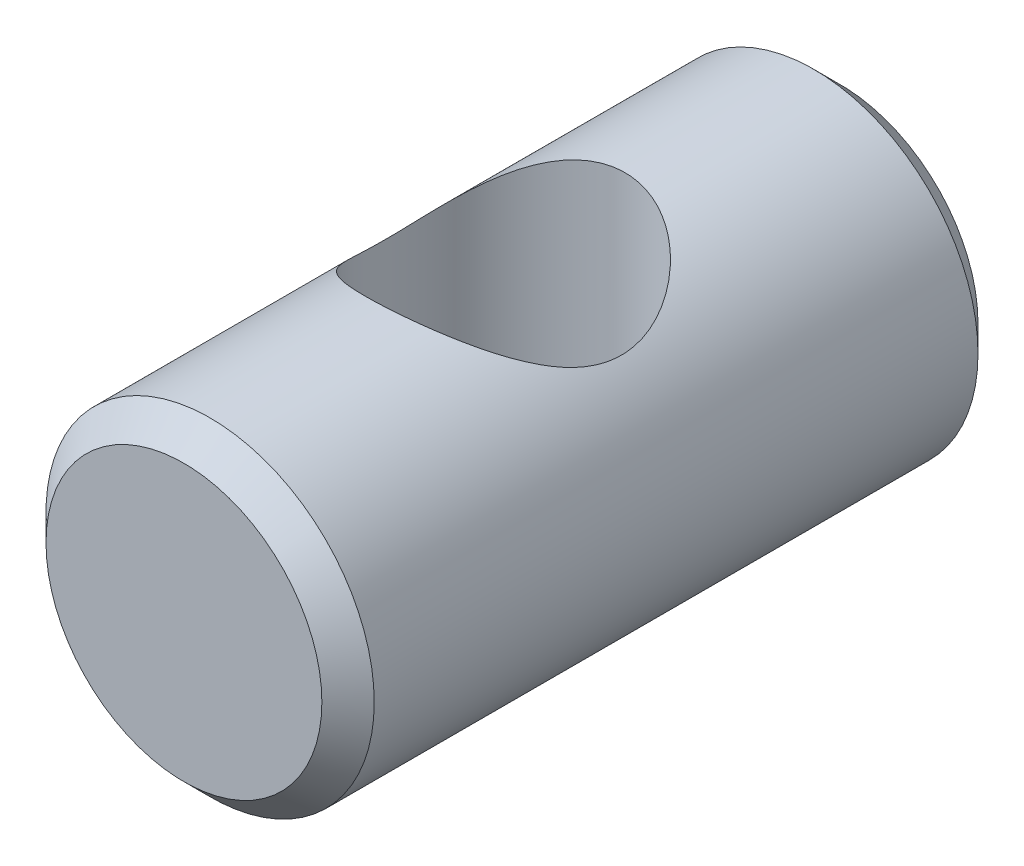
from build123d import *

# Parameters (mm, degrees)
SKETCH1_R               = 4.765
BOSS_EXTRUDE1_DEPTH     = 9.525
CHAMFER1_SIZE           = 0.76
CUT_EXTRUDE1_DEPTH      = 12.667736499
CUT_EXTRUDE1_DEPTH_BACK = 12.667736499
SKETCH2_R               = 3.43


with BuildPart() as part:
    # Sketch1 → Boss-Extrude1 (new, symmetric)
    with BuildSketch(Plane.XY):
        with Locations(Location((0, 0, 0), (0, 0, 180))):
            Circle(SKETCH1_R)
    extrude(amount=BOSS_EXTRUDE1_DEPTH, both=True)

    # Chamfer1
    chamfer1_edges = [part.edges().sort_by_distance(p)[0] for p in [
        (4.765, 0, -9.525),
        (4.765, 0, 9.525),
    ]]
    chamfer(chamfer1_edges, length=CHAMFER1_SIZE)

    # Sketch2 → Cut-Extrude1 (cut, two sides: drawn at the far end of the back side and taken through both)
    with BuildSketch(Plane(origin=(0, 0, 0), x_dir=(1, 0, 0), z_dir=(0, 1, 0)).offset(-CUT_EXTRUDE1_DEPTH_BACK)):
        with Locations(Location((-0.25, 0, 0), (0, 0, 270))):
            Circle(SKETCH2_R)
    extrude(amount=CUT_EXTRUDE1_DEPTH + CUT_EXTRUDE1_DEPTH_BACK, mode=Mode.SUBTRACT)


solid = part.part
